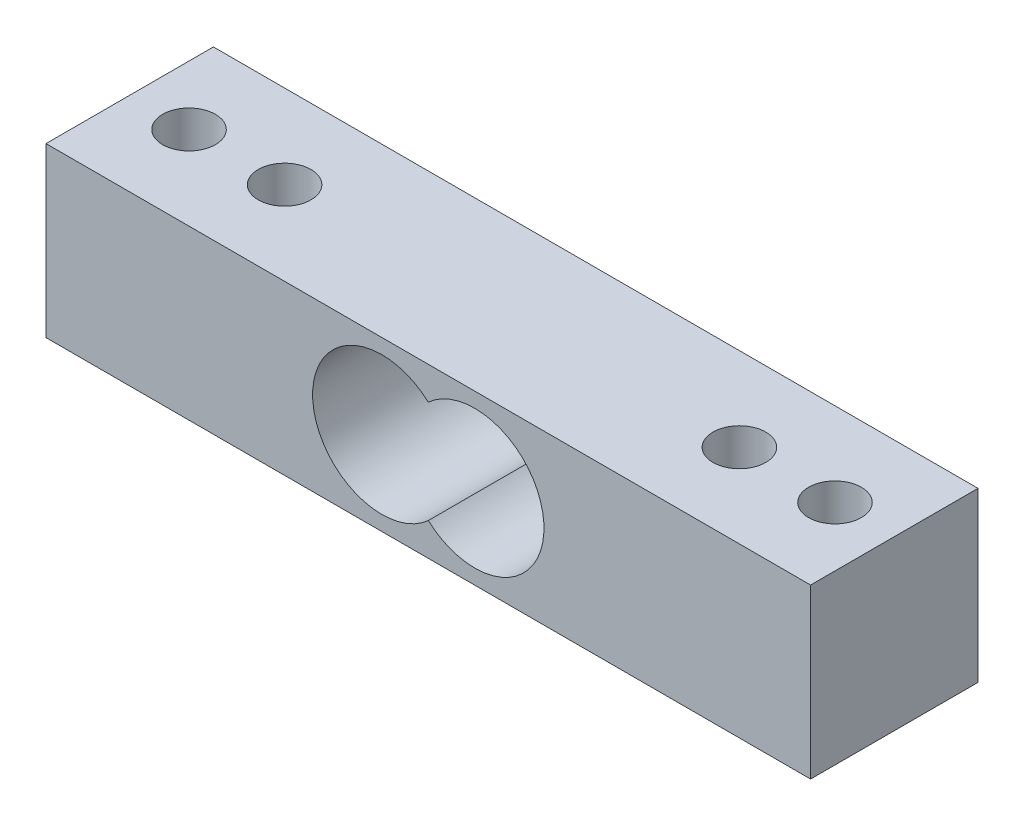
from build123d import *

# Parameters (mm, degrees)
SKETCH1_W               = 58
SKETCH1_H               = 12.7
SKETCH1_R               = 2
BOSS_EXTRUDE1_DEPTH     = 12.75
CUT_EXTRUDE2_DEPTH      = 35.129935541
CUT_EXTRUDE2_DEPTH_BACK = 35.129935541


with BuildPart() as part:
    # Sketch1 → Boss-Extrude1 (new body)
    with BuildSketch(Plane(origin=(0, 0, 0), x_dir=(1, 0, 0), z_dir=(0, 1, 0))):
        Rectangle(SKETCH1_W, SKETCH1_H)
        with Locations(Location((-24.5, 0, 0), (0, 0, 270))):
            Circle(SKETCH1_R, mode=Mode.SUBTRACT)
        with Locations(Location((-17.25, 0, 0), (0, 0, 270))):
            Circle(SKETCH1_R, mode=Mode.SUBTRACT)
        with Locations(Location((24.5, 0, 0), (0, 0, 270))):
            Circle(SKETCH1_R, mode=Mode.SUBTRACT)
        with Locations(Location((17.25, 0, 0), (0, 0, 270))):
            Circle(SKETCH1_R, mode=Mode.SUBTRACT)
    extrude(amount=BOSS_EXTRUDE1_DEPTH)

    # Sketch2 → Cut-Extrude2 (cut, two sides: drawn at the far end of the back side and taken through both)
    with BuildSketch(Plane.XY.offset(6.35).offset(-CUT_EXTRUDE2_DEPTH_BACK)):
        with BuildLine():
            ThreePointArc((0, 10.265613705), (-8.775, 6.375), (0, 2.484386295))
            ThreePointArc((0, 2.484386295), (8.775, 6.375), (0, 10.265613705))
        make_face()
    extrude(amount=CUT_EXTRUDE2_DEPTH + CUT_EXTRUDE2_DEPTH_BACK, mode=Mode.SUBTRACT)


solid = part.part
